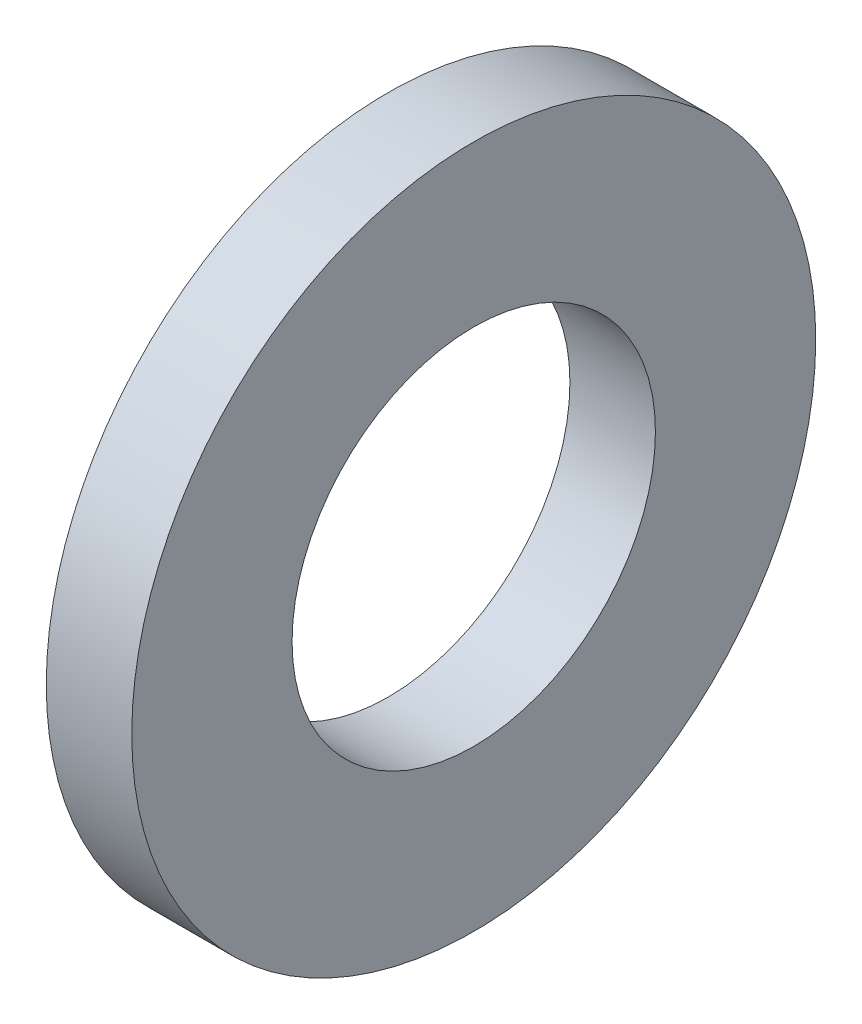
from build123d import *

# Parameters (mm, degrees)
SKETCH_1_R      = 3.2
SKETCH_1_R_2    = 1.7
EXTRUDE_1_DEPTH = 0.8


with BuildPart() as part:
    # 草图1 → 凸台-拉伸1 (new body)
    with BuildSketch(Plane(origin=(0, 0, 0), x_dir=(0, 0, -1), z_dir=(1, 0, 0))):
        Circle(SKETCH_1_R)
        Circle(SKETCH_1_R_2, mode=Mode.SUBTRACT)
    extrude(amount=EXTRUDE_1_DEPTH)


solid = part.part
